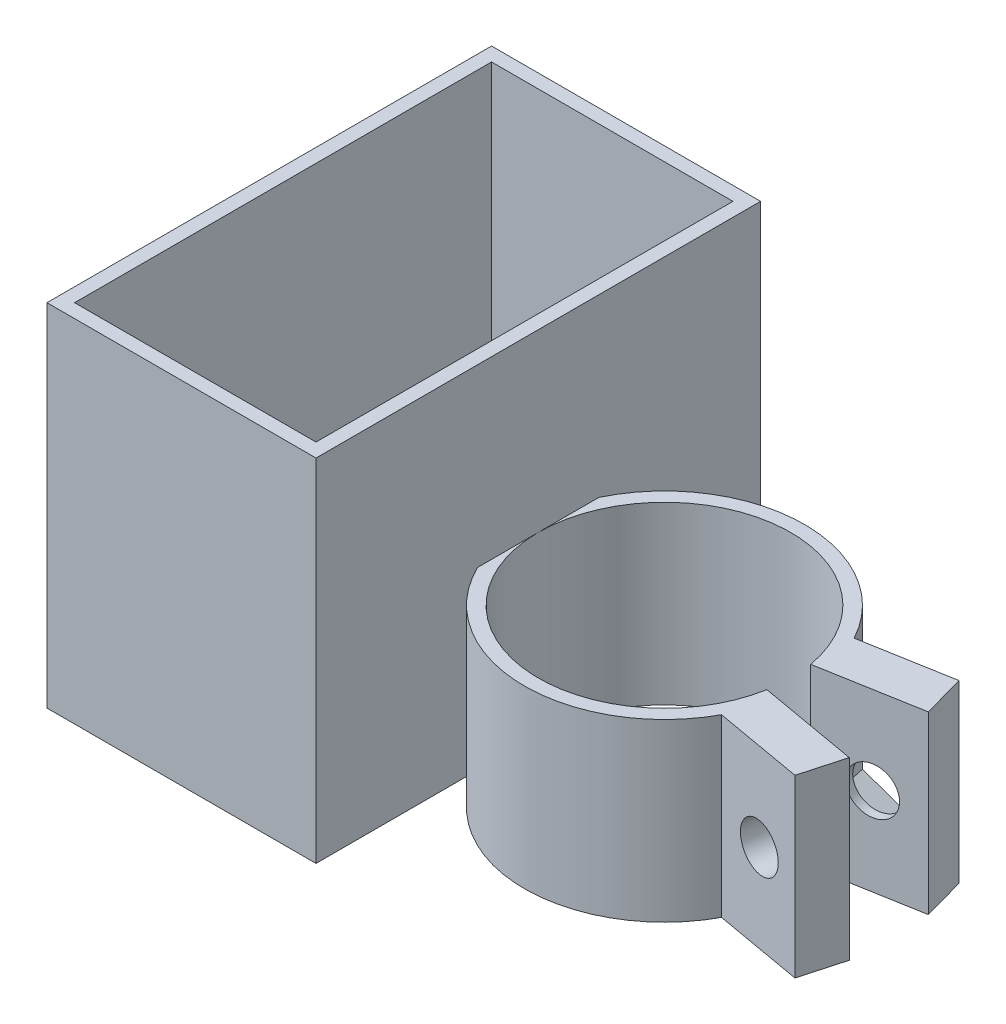
from build123d import *

# Parameters (mm, degrees)
BOSS_EXTRUDE1_DEPTH = 25.4
CUT_EXTRUDE1_REACH  = 51.74
SKETCH3_R           = 3.3734375
CUT_EXTRUDE2_REACH  = 51.74
SKETCH4_R           = 3.3734375
SKETCH6_W           = 38.925
SKETCH6_H           = 64.325
SKETCH6_W_2         = 34.925
SKETCH6_H_2         = 60.325
BOSS_EXTRUDE4_DEPTH = 50.8
CUT_EXTRUDE3_DEPTH  = 5.08
CUT_EXTRUDE3_DRAFT  = -4.3
SKETCH9_W           = 34.925
SKETCH9_H           = 60.325
BOSS_EXTRUDE6_DEPTH = 3.175


with BuildPart() as part:
    # Sketch1 → Boss-Extrude1 (new body)
    with BuildSketch(Plane(origin=(0, 0, 0), x_dir=(1, 0, 0), z_dir=(0, 1, 0))):
        with BuildLine():
            Line((17.840314435, -9.593687765), (19.948512047, -3.517460899))
            Line((19.948512047, -3.517460899), (17.978896541, -3.170164544))
            ThreePointArc((17.978896541, -3.170164544), (-18.25625, 0), (17.978896541, 3.170164544))
            Line((17.978896541, 3.170164544), (19.948512047, 3.517460899))
            Line((19.948512047, 3.517460899), (17.840314435, 9.593687765))
            ThreePointArc((17.840314435, 9.593687765), (-20.25625, 0), (17.840314435, -9.593687765))
        make_face()
        with BuildLine():
            Line((30.744742589, 11.869086619), (17.840314435, 9.593687765))
            ThreePointArc((17.840314435, 9.593687765), (19.137110151, 6.63978005), (19.948512047, 3.517460899))
            Line((19.948512047, 3.517460899), (32.45557051, 5.722792755))
            Line((32.45557051, 5.722792755), (30.744742589, 11.869086619))
        make_face()
        with BuildLine():
            Line((32.45557051, -5.722792755), (19.948512047, -3.517460899))
            ThreePointArc((19.948512047, -3.517460899), (19.137110151, -6.63978005), (17.840314435, -9.593687765))
            Line((17.840314435, -9.593687765), (30.744742589, -11.869086619))
            Line((30.744742589, -11.869086619), (32.45557051, -5.722792755))
        make_face()
        with BuildLine():
            ThreePointArc((17.840314435, -9.593687765), (19.137110151, -6.63978005), (19.948512047, -3.517460899))
            Line((19.948512047, -3.517460899), (17.840314435, -9.593687765))
        make_face()
        with BuildLine():
            ThreePointArc((19.948512047, 3.517460899), (19.137110151, 6.63978005), (17.840314435, 9.593687765))
            Line((17.840314435, 9.593687765), (19.948512047, 3.517460899))
        make_face()
    extrude(amount=BOSS_EXTRUDE1_DEPTH)

    # Sketch3 → Cut-Extrude1 (cut, up to next)
    with BuildSketch(Plane(origin=(-1.102665928, 0, 6.253529232), x_dir=(0.984807753012208, 0, 0.17364817766693044), z_dir=(-0.17364817766693044, 0, 0.984807753012208)), mode=Mode.PRIVATE) as cut_extrude1_sk1:
        with Locations((25.988706128, 12.7)):
            Circle(SKETCH3_R)
    cut_extrude1_tool1 = extrude(cut_extrude1_sk1.sketch, amount=-CUT_EXTRUDE1_REACH, mode=Mode.PRIVATE) & part.part
    add(cut_extrude1_tool1.solids().sort_by_distance((24.491213, 12.7, 10.766421))[0], mode=Mode.SUBTRACT)

    # Sketch4 → Cut-Extrude2 (cut, up to next)
    with BuildSketch(Plane(origin=(-1.102665928, 0, -6.253529232), x_dir=(-0.984807753012208, 0, 0.17364817766693136), z_dir=(-0.17364817766693136, 0, -0.984807753012208)), mode=Mode.PRIVATE) as cut_extrude2_sk1:
        with Locations((-25.988706128, 12.7)):
            Circle(SKETCH4_R)
    cut_extrude2_tool1 = extrude(cut_extrude2_sk1.sketch, amount=-CUT_EXTRUDE2_REACH, mode=Mode.PRIVATE) & part.part
    add(cut_extrude2_tool1.solids().sort_by_distance((24.491213, 12.7, -10.766421))[0], mode=Mode.SUBTRACT)

    # Sketch6 → Boss-Extrude4 (add)
    with BuildSketch(Plane.XZ):
        with Locations((-37.71875, 0)):
            Rectangle(SKETCH6_W, SKETCH6_H)
        with Locations((-37.71875, 0)):
            Rectangle(SKETCH6_W_2, SKETCH6_H_2, mode=Mode.SUBTRACT)
    extrude(amount=-BOSS_EXTRUDE4_DEPTH)


with BuildPart() as cut_extrude3_tool:
    # Sketch8 → Cut-Extrude3 (with draft: the straight prism first)
    with BuildSketch(Plane(origin=(-1.102665928, 0, -6.253529232), x_dir=(-0.984807753012208, 0, 0.17364817766693136), z_dir=(-0.17364817766693136, 0, -0.984807753012208))):
        Polygon((-20.273706128, 9.400443212), (-20.273706128, 15.999556788), (-25.988706128, 19.299113577), (-31.703706128, 15.999556788), (-31.703706128, 9.400443212), (-25.988706128, 6.100886423), align=None)
    extrude(amount=-CUT_EXTRUDE3_DEPTH)
    # Cut-Extrude3: the draft: its side faces are tilted about the plane it starts from
    cut_extrude3_sides = [cut_extrude3_tool.faces().sort_by_distance(p)[0] for p in [
        (19.304103421, 12.7, -7.272609663),
        (22.118191575, 17.649335183, -7.76880933),
        (27.746367883, 17.649335183, -8.761208666),
        (30.560456038, 12.7, -9.257408333),
        (27.746367883, 7.750664817, -8.761208666),
        (22.118191575, 7.750664817, -7.76880933),
    ]]
    draft(cut_extrude3_sides, Plane(origin=(-1.102665928, 0, -6.253529232), x_dir=(-0.984807753012208, 0, 0.17364817766693136), z_dir=(-0.17364817766693136, 0, -0.984807753012208)), CUT_EXTRUDE3_DRAFT)


with BuildPart() as part_1:
    add(part.part)

    # Cut-Extrude3: cut by cut_extrude3_tool
    add(cut_extrude3_tool.part, mode=Mode.SUBTRACT)

    # Sketch9 → Boss-Extrude6 (add)
    with BuildSketch(Plane.XZ):
        with Locations((-37.71875, 0)):
            Rectangle(SKETCH9_W, SKETCH9_H)
    extrude(amount=-BOSS_EXTRUDE6_DEPTH)


solid = part_1.part
